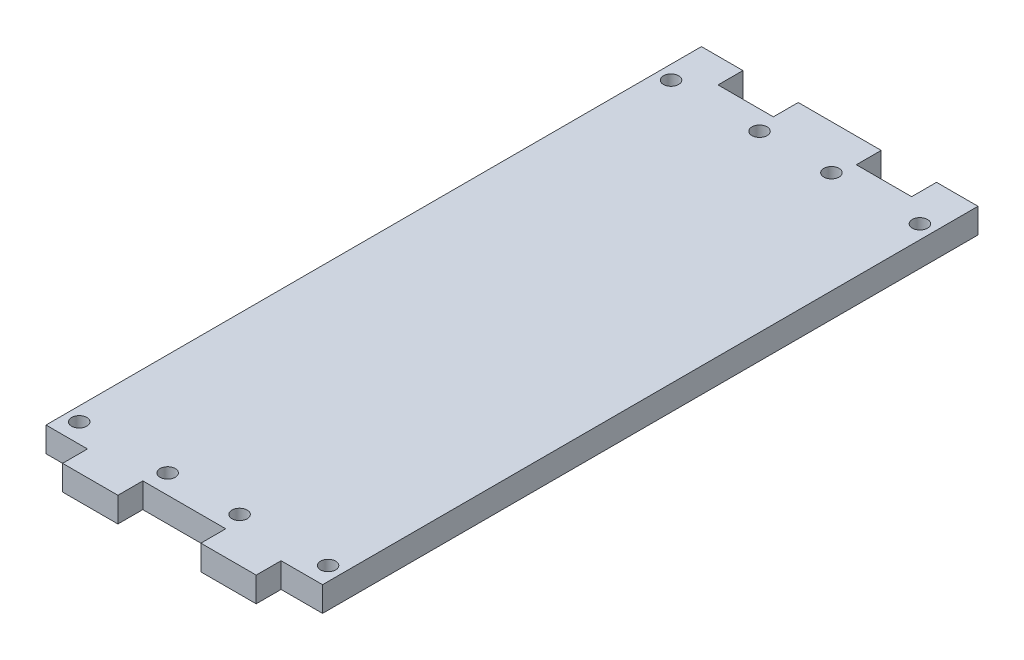
from build123d import *

# Parameters (mm, degrees)
BOSS_EXTRUDE1_DEPTH = 9
SKETCH2_R           = 2.75
CUT_EXTRUDE1_DEPTH  = 10


with BuildPart() as part:
    # Sketch1 → Boss-Extrude1 (new body)
    with BuildSketch(Plane(origin=(0, 0, 0), x_dir=(1, 0, 0), z_dir=(0, 1, 0))):
        Polygon((-35, 118.5), (-50, 118.5), (-50, -118.5), (-35, -118.5), (-35, -127.5), (-15, -127.5), (-15, -118.5), (15, -118.5), (15, -127.5), (35, -127.5), (35, -118.5), (50, -118.5), (50, 118.5), (35, 118.5), (35, 109.5), (15, 109.5), (15, 118.5), (-15, 118.5), (-15, 109.5), (-35, 109.5), align=None)
    extrude(amount=BOSS_EXTRUDE1_DEPTH)

    # Sketch2 → Cut-Extrude1 (cut)
    with BuildSketch(Plane(origin=(0, 9, 0), x_dir=(1, 0, 0), z_dir=(0, 1, 0))):
        with Locations(Location((-45, -111.5, 0), (0, 0, 270))):
            Circle(SKETCH2_R)
        with Locations(Location((-13, -111.5, 0), (0, 0, 270))):
            Circle(SKETCH2_R)
        with Locations(Location((13, -111.5, 0), (0, 0, 270))):
            Circle(SKETCH2_R)
        with Locations(Location((45, -111.5, 0), (0, 0, 270))):
            Circle(SKETCH2_R)
        with Locations(Location((-45, 102.5, 0), (0, 0, 270))):
            Circle(SKETCH2_R)
        with Locations(Location((-13, 102.5, 0), (0, 0, 270))):
            Circle(SKETCH2_R)
        with Locations(Location((13, 102.5, 0), (0, 0, 270))):
            Circle(SKETCH2_R)
        with Locations(Location((45, 102.5, 0), (0, 0, 270))):
            Circle(SKETCH2_R)
    extrude(amount=-CUT_EXTRUDE1_DEPTH, mode=Mode.SUBTRACT)


solid = part.part
